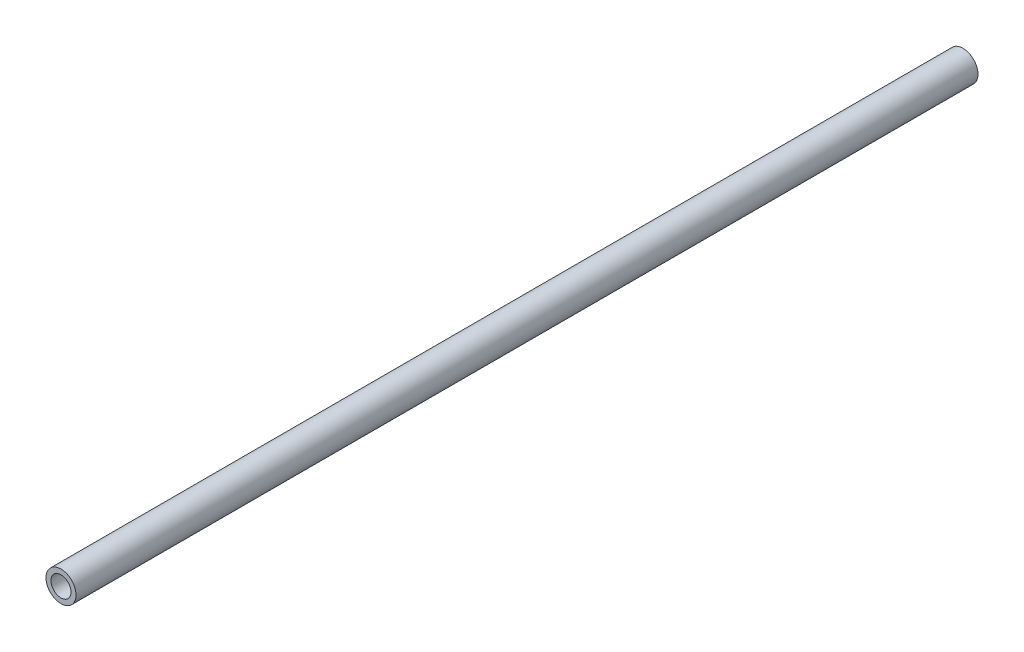
from build123d import *

# Parameters (mm, degrees)
SKETCH1_R           = 3
SKETCH1_R_2         = 2
BOSS_EXTRUDE1_DEPTH = 180.18


with BuildPart() as part:
    # Sketch1 → Boss-Extrude1 (new body)
    with BuildSketch(Plane.XY):
        Circle(SKETCH1_R)
        Circle(SKETCH1_R_2, mode=Mode.SUBTRACT)
    extrude(amount=BOSS_EXTRUDE1_DEPTH)


solid = part.part
